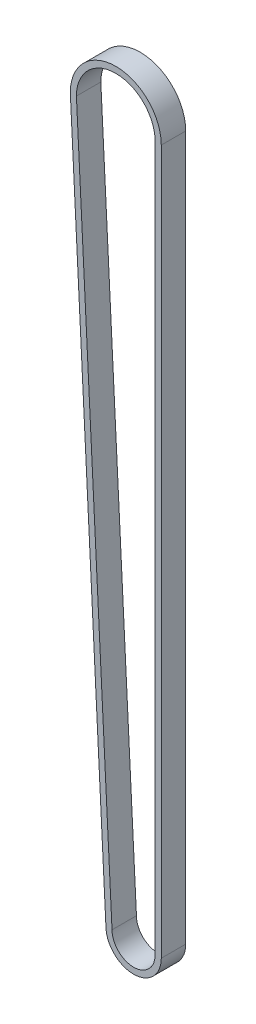
from build123d import *

# Parameters (mm, degrees)
EXTRUSION1_DEPTH = 6


with BuildPart() as part:
    # Esquisse1 → Extrusion1 (new body)
    with BuildSketch(Plane.XY):
        with BuildLine():
            Line((5.541704484, 47.640174037), (5.541704484, -125.359825963))
            ThreePointArc((5.541704484, -125.359825963), (-1.258295516, -132.159825963), (-8.058295516, -125.359825963))
            Line((-8.058295516, -125.359825963), (-16.808295516, 47.640174037))
            ThreePointArc((-16.808295516, 47.640174037), (-5.633295516, 58.815174037), (5.541704484, 47.640174037))
        make_face()
        with BuildLine():
            Line((4.041704484, 47.640174037), (4.041704484, -125.359825963))
            ThreePointArc((4.041704484, -125.359825963), (-1.258295516, -130.659825963), (-6.558295516, -125.359825963))
            Line((-6.558295516, -125.359825963), (-15.308295516, 47.640174037))
            ThreePointArc((-15.308295516, 47.640174037), (-5.633295516, 57.315174037), (4.041704484, 47.640174037))
        make_face(mode=Mode.SUBTRACT)
    extrude(amount=EXTRUSION1_DEPTH)


solid = part.part
